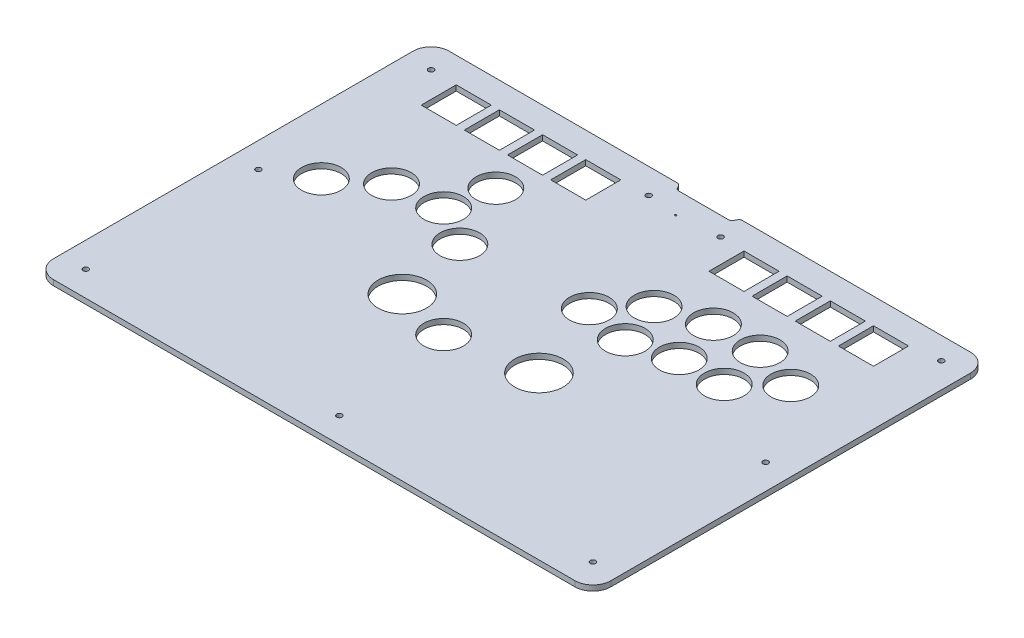
from build123d import *

# Parameters (mm, degrees)
SKETCH_1_R      = 11
SKETCH_1_R_2    = 1.5
SKETCH_1_R_3    = 13.5
SKETCH_1_R_4    = 0.5
SKETCH_1_W      = 19.5
SKETCH_1_H      = 19.5
EXTRUDE_1_DEPTH = 3


with BuildPart() as part:
    # 草图1 → 凸台-拉伸1 (new body)
    with BuildSketch(Plane(origin=(0, 0, 0), x_dir=(1, 0, 0), z_dir=(0, 1, 0))):
        with BuildLine():
            Line((10, 0), (136.884360712, 0))
            ThreePointArc((136.884360712, 0), (137.900113715, -0.277140216), (138.634360712, -1.031754163))
            Line((138.634360712, -1.031754163), (139.429147615, -2.468245837))
            ThreePointArc((139.429147615, -2.468245837), (140.163394612, -3.222859784), (141.179147615, -3.5))
            Line((141.179147615, -3.5), (168.820852385, -3.5))
            ThreePointArc((168.820852385, -3.5), (169.836605388, -3.222859784), (170.570852385, -2.468245837))
            Line((170.570852385, -2.468245837), (171.365639288, -1.031754163))
            ThreePointArc((171.365639288, -1.031754163), (172.099886285, -0.277140216), (173.115639288, 0))
            Line((173.115639288, 0), (300, 0))
            ThreePointArc((300, 0), (307.071067812, -2.928932188), (310, -10))
            Line((310, -10), (310, -210))
            ThreePointArc((310, -210), (307.071067812, -217.071067812), (300, -220))
            Line((300, -220), (10, -220))
            ThreePointArc((10, -220), (2.928932188, -217.071067812), (0, -210))
            Line((0, -210), (0, -10))
            ThreePointArc((0, -10), (2.928932188, -2.928932188), (10, 0))
        make_face()
        with Locations(Location((173, -85, 0), (0, 0, 270))):
            Circle(SKETCH_1_R, mode=Mode.SUBTRACT)
        with Locations(Location((190, -66, 0), (0, 0, 270))):
            Circle(SKETCH_1_R, mode=Mode.SUBTRACT)
        with Locations(Location((215, -58, 0), (0, 0, 270))):
            Circle(SKETCH_1_R, mode=Mode.SUBTRACT)
        with Locations(Location((222, -84, 0), (0, 0, 270))):
            Circle(SKETCH_1_R, mode=Mode.SUBTRACT)
        with Locations(Location((247, -84, 0), (0, 0, 270))):
            Circle(SKETCH_1_R, mode=Mode.SUBTRACT)
        with Locations(Location((241, -58, 0), (0, 0, 270))):
            Circle(SKETCH_1_R, mode=Mode.SUBTRACT)
        with Locations(Location((14, -14, 0), (0, 0, 270))):
            Circle(SKETCH_1_R_2, mode=Mode.SUBTRACT)
        with Locations(Location((14, -206, 0), (0, 0, 270))):
            Circle(SKETCH_1_R_2, mode=Mode.SUBTRACT)
        with Locations(Location((296, -206, 0), (0, 0, 270))):
            Circle(SKETCH_1_R_2, mode=Mode.SUBTRACT)
        with Locations(Location((296, -12.28568254, 0), (0, 0, 270))):
            Circle(SKETCH_1_R_2, mode=Mode.SUBTRACT)
        with Locations(Location((198, -90, 0), (0, 0, 270))):
            Circle(SKETCH_1_R, mode=Mode.SUBTRACT)
        with Locations(Location((114, -130, 0), (0, 0, 270))):
            Circle(SKETCH_1_R_3, mode=Mode.SUBTRACT)
        with Locations(Location((190, -130, 0), (0, 0, 270))):
            Circle(SKETCH_1_R_3, mode=Mode.SUBTRACT)
        with Locations(Location((155, -206, 0), (0, 0, 270))):
            Circle(SKETCH_1_R_2, mode=Mode.SUBTRACT)
        with Locations(Location((175, -14, 0), (0, 0, 270))):
            Circle(SKETCH_1_R_2, mode=Mode.SUBTRACT)
        with Locations(Location((145, -138, 0), (0, 0, 270))):
            Circle(SKETCH_1_R, mode=Mode.SUBTRACT)
        with Locations(Location((106, -90, 0), (0, 0, 270))):
            Circle(SKETCH_1_R, mode=Mode.SUBTRACT)
        with Locations(Location((84, -77, 0), (0, 0, 270))):
            Circle(SKETCH_1_R, mode=Mode.SUBTRACT)
        with Locations(Location((58, -80, 0), (0, 0, 270))):
            Circle(SKETCH_1_R, mode=Mode.SUBTRACT)
        with Locations(Location((36, -97, 0), (0, 0, 270))):
            Circle(SKETCH_1_R, mode=Mode.SUBTRACT)
        with Locations(Location((89, -53, 0), (0, 0, 270))):
            Circle(SKETCH_1_R, mode=Mode.SUBTRACT)
        with Locations(Location((266, -66, 0), (0, 0, 270))):
            Circle(SKETCH_1_R, mode=Mode.SUBTRACT)
        with Locations(Location((135, -14, 0), (0, 0, 270))):
            Circle(SKETCH_1_R_2, mode=Mode.SUBTRACT)
        with Locations(Location((296, -110, 0), (0, 0, 270))):
            Circle(SKETCH_1_R_2, mode=Mode.SUBTRACT)
        with Locations(Location((14, -110, 0), (0, 0, 270))):
            Circle(SKETCH_1_R_2, mode=Mode.SUBTRACT)
        with Locations(Location((152, -16, 0), (0, 0, 270))):
            Circle(SKETCH_1_R_4, mode=Mode.SUBTRACT)
        with Locations((38, -24)):
            Rectangle(SKETCH_1_W, SKETCH_1_H, mode=Mode.SUBTRACT)
        with Locations((62, -24)):
            Rectangle(SKETCH_1_W, SKETCH_1_H, mode=Mode.SUBTRACT)
        with Locations((86, -24)):
            Rectangle(SKETCH_1_W, SKETCH_1_H, mode=Mode.SUBTRACT)
        with Locations((110, -24)):
            Rectangle(SKETCH_1_W, SKETCH_1_H, mode=Mode.SUBTRACT)
        with Locations((198, -24)):
            Rectangle(SKETCH_1_W, SKETCH_1_H, mode=Mode.SUBTRACT)
        with Locations((222, -24)):
            Rectangle(SKETCH_1_W, SKETCH_1_H, mode=Mode.SUBTRACT)
        with Locations((246, -24)):
            Rectangle(SKETCH_1_W, SKETCH_1_H, mode=Mode.SUBTRACT)
        with Locations((270, -24)):
            Rectangle(SKETCH_1_W, SKETCH_1_H, mode=Mode.SUBTRACT)
    extrude(amount=EXTRUDE_1_DEPTH)


solid = part.part
